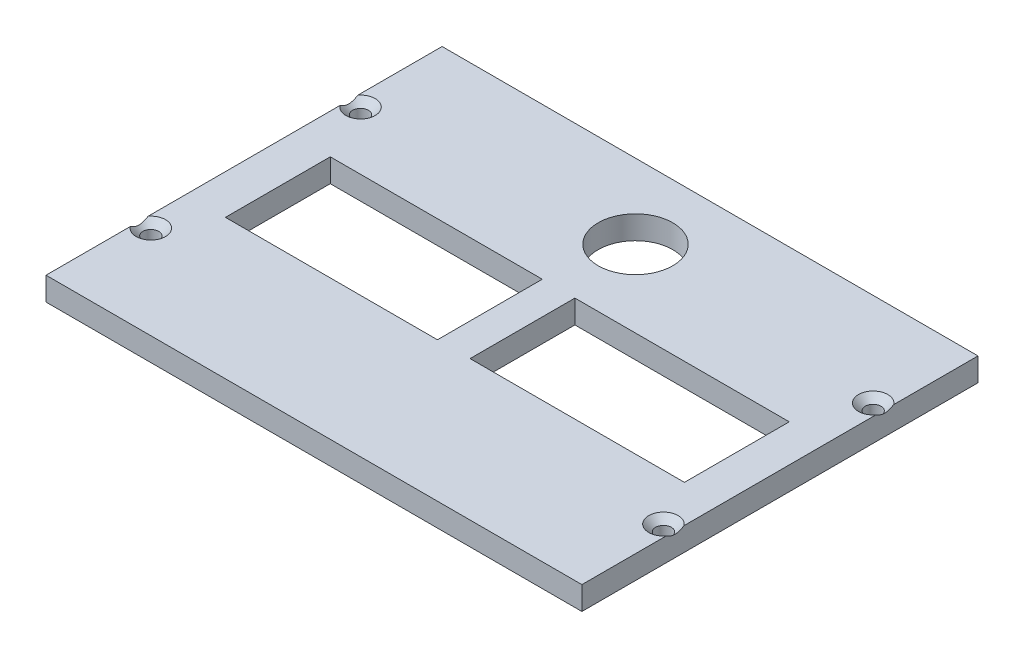
from build123d import *

# Parameters (mm, degrees)
SKETCH1_W                                           = 115
SKETCH1_H                                           = 85
SKETCH1_R                                           = 8
SKETCH1_W_2                                         = 45.5
SKETCH1_H_2                                         = 22.5
SKETCH1_W_3                                         = 46
BOSS_EXTRUDE1_DEPTH                                 = 5
CSK_FOR_M3_FLAT_COUNTERSUNK_HEAD_SCREW1_D           = 3.4
CSK_FOR_M3_FLAT_COUNTERSUNK_HEAD_SCREW1_CSINK_D     = 6.3
CSK_FOR_M3_FLAT_COUNTERSUNK_HEAD_SCREW1_CSINK_ANGLE = 90


with BuildPart() as part:
    # Sketch1 → Boss-Extrude1 (new body)
    with BuildSketch(Plane(origin=(0, 0, 0), x_dir=(1, 0, 0), z_dir=(0, 1, 0))):
        with Locations((57.5, 42.5)):
            Rectangle(SKETCH1_W, SKETCH1_H)
        with Locations(Location((57.5, 69, 0), (0, 0, 270))):
            Circle(SKETCH1_R, mode=Mode.SUBTRACT)
        with Locations((31.25, 41.25)):
            Rectangle(SKETCH1_W_2, SKETCH1_H_2, mode=Mode.SUBTRACT)
        with Locations((84, 41.25)):
            Rectangle(SKETCH1_W_3, SKETCH1_H_2, mode=Mode.SUBTRACT)
    extrude(amount=-BOSS_EXTRUDE1_DEPTH)

    # CSK for M3 Flat Countersunk Head Screw1 (through all)
    with Locations(Plane(origin=(0, 0, 0), x_dir=(1, 0, 0), z_dir=(0, 1, 0))):
        with Locations((2.5, 65), (2.5, 20), (112.5, 65), (112.5, 20)):
            CounterSinkHole(CSK_FOR_M3_FLAT_COUNTERSUNK_HEAD_SCREW1_D / 2, CSK_FOR_M3_FLAT_COUNTERSUNK_HEAD_SCREW1_CSINK_D / 2, counter_sink_angle=CSK_FOR_M3_FLAT_COUNTERSUNK_HEAD_SCREW1_CSINK_ANGLE)


solid = part.part
